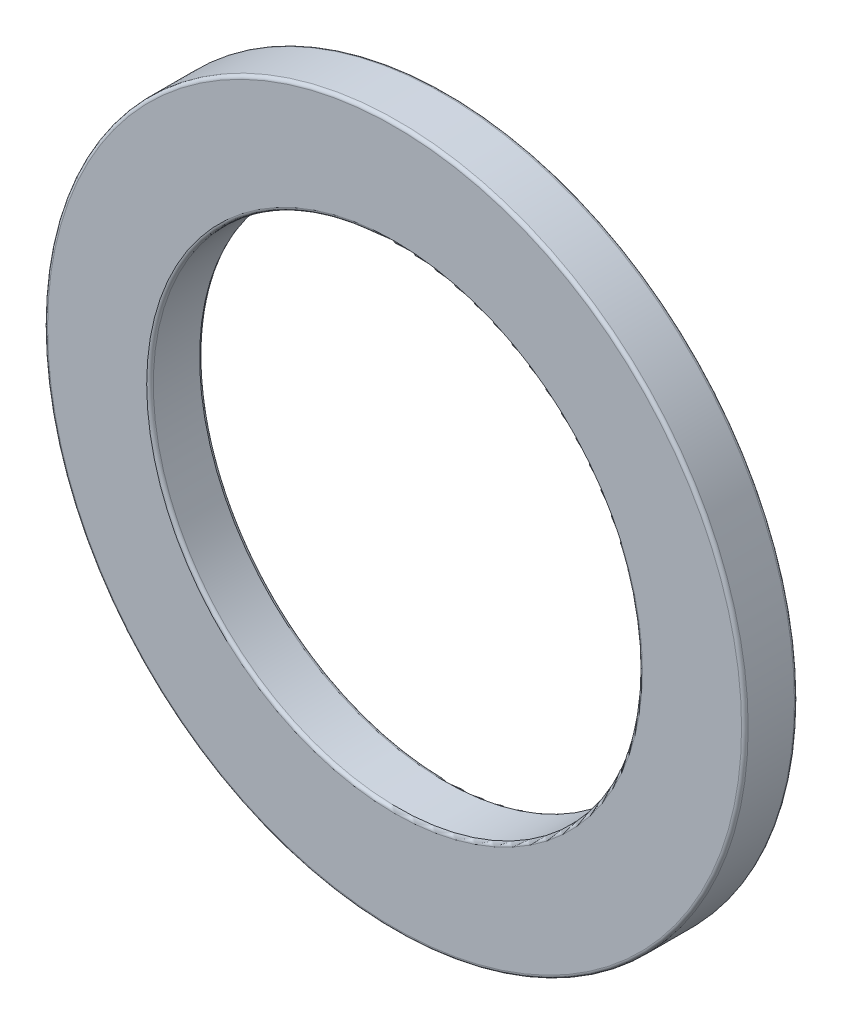
from build123d import *

# Parameters (mm, degrees)
SKETCH_1_R      = 53
SKETCH_1_R_2    = 37
EXTRUDE_1_DEPTH = 8
FILLET_1_R      = 0.5


with BuildPart() as part:
    # Эскиз1 → Бобышка-Вытянуть1 (new body)
    with BuildSketch(Plane.XY):
        Circle(SKETCH_1_R)
        Circle(SKETCH_1_R_2, mode=Mode.SUBTRACT)
    extrude(amount=EXTRUDE_1_DEPTH)

    # Скругление1
    fillet_1_edges = [part.edges().sort_by_distance(p)[0] for p in [
        (-53, 0, 0),
        (-53, 0, 8),
        (-37, 0, 0),
        (-37, 0, 8),
    ]]
    fillet(fillet_1_edges, radius=FILLET_1_R)


solid = part.part
